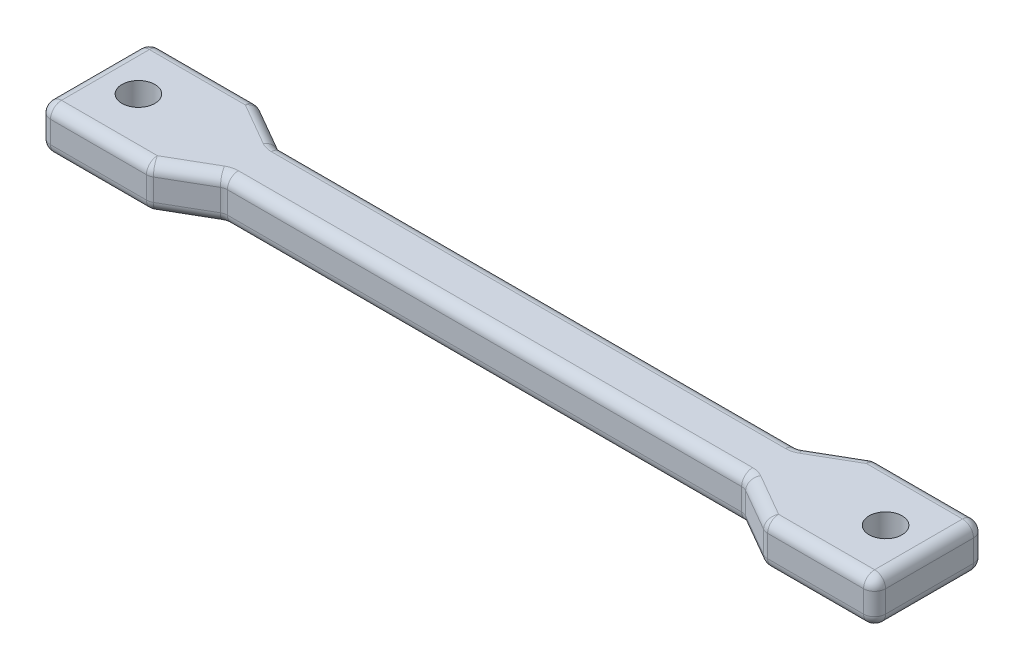
from build123d import *

# Parameters (mm, degrees)
SKETCH1_W           = 76
SKETCH1_H           = 10
BOSS_EXTRUDE1_DEPTH = 4
SKETCH2_R           = 1.5
CUT_EXTRUDE1_DEPTH  = 4
CUT_EXTRUDE2_DEPTH  = 10
FILLET1_R           = 1


with BuildPart() as part:
    # Sketch1 → Boss-Extrude1 (new body)
    with BuildSketch(Plane(origin=(0, 0, 0), x_dir=(1, 0, 0), z_dir=(0, 1, 0))):
        Rectangle(SKETCH1_W, SKETCH1_H)
    extrude(amount=BOSS_EXTRUDE1_DEPTH)

    # Sketch2 → Cut-Extrude1 (cut)
    with BuildSketch(Plane(origin=(0, 4, 0), x_dir=(1, 0, 0), z_dir=(0, 1, 0))):
        with Locations(Location((-34, 0, 0), (0, 0, 270))):
            Circle(SKETCH2_R)
        with Locations(Location((34, 0, 0), (0, 0, 270))):
            Circle(SKETCH2_R)
    extrude(amount=-CUT_EXTRUDE1_DEPTH, mode=Mode.SUBTRACT)

    # Sketch3 → Cut-Extrude2 (cut)
    with BuildSketch(Plane(origin=(0, 4, 0), x_dir=(1, 0, 0), z_dir=(0, 1, 0))):
        Polygon((-28, 5), (-23.669872981, 2.5), (23.669872981, 2.5), (28, 5), align=None)
        Polygon((-28, -5), (-23.669872981, -2.5), (23.669872981, -2.5), (28, -5), align=None)
    extrude(amount=-CUT_EXTRUDE2_DEPTH, mode=Mode.SUBTRACT)

    # Fillet1
    fillet1_edges = [part.edges().sort_by_distance(p)[0] for p in [
        (-38, 4, 0),
        (-33, 4, 5),
        (33, 0, 5),
        (-33, 0, -5),
        (25.834936491, 0, 3.75),
        (0, 0, 2.5),
        (-25.834936491, 0, 3.75),
        (-25.834936491, 0, -3.75),
        (0, 0, -2.5),
        (25.834936491, 0, -3.75),
        (-33, 4, -5),
        (33, 4, 5),
        (-28, 2, -5),
        (28, 2, -5),
        (23.669872981, 2, -2.5),
        (-23.669872981, 2, -2.5),
        (-25.834936491, 4, -3.75),
        (0, 4, -2.5),
        (25.834936491, 4, -3.75),
        (28, 2, 5),
        (-28, 2, 5),
        (-23.669872981, 2, 2.5),
        (23.669872981, 2, 2.5),
        (25.834936491, 4, 3.75),
        (0, 4, 2.5),
        (-25.834936491, 4, 3.75),
        (38, 4, 0),
        (-33, 0, 5),
        (-38, 0, 0),
        (33, 0, -5),
        (38, 0, 0),
        (38, 2, 5),
        (-38, 2, 5),
        (-38, 2, -5),
        (38, 2, -5),
        (33, 4, -5),
    ]]
    fillet(fillet1_edges, radius=FILLET1_R)


solid = part.part
